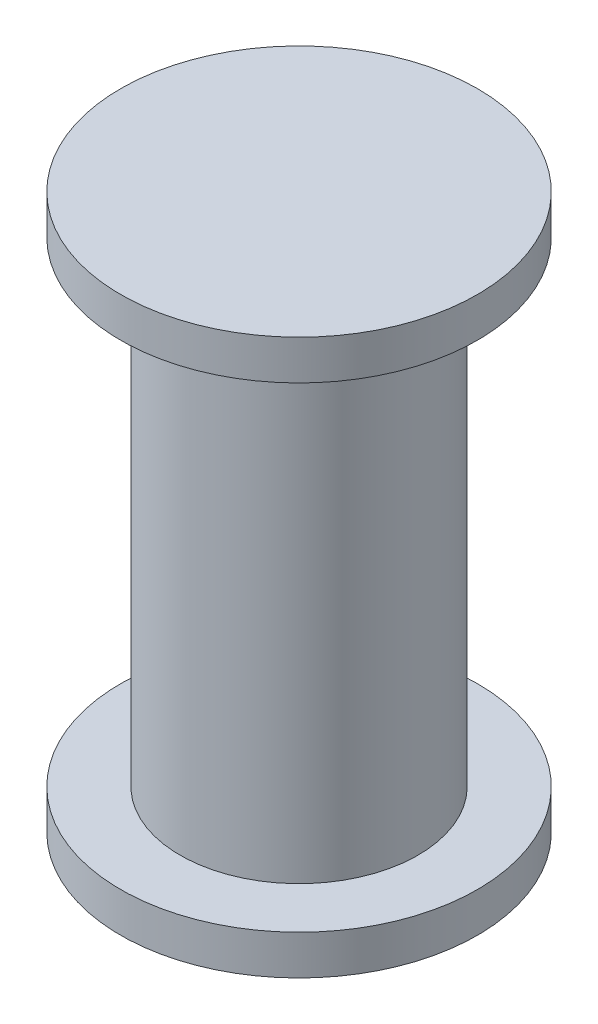
from build123d import *


with BuildPart() as part:
    # Sketch1 → Revolve1 (revolve)
    with BuildSketch(Plane.XY, mode=Mode.PRIVATE) as revolve1_sk:
        Polygon((0, 0), (0, 14), (-4.5, 14), (-4.5, 13), (-3, 13), (-3, 1), (-4.5, 1), (-4.5, 0), align=None)
    revolve(revolve1_sk.sketch.rotate(Axis((0, 0, 0), (0, 1, 0)), 270), axis=Axis((0, 0, 0), (0, 1, 0)))


solid = part.part
